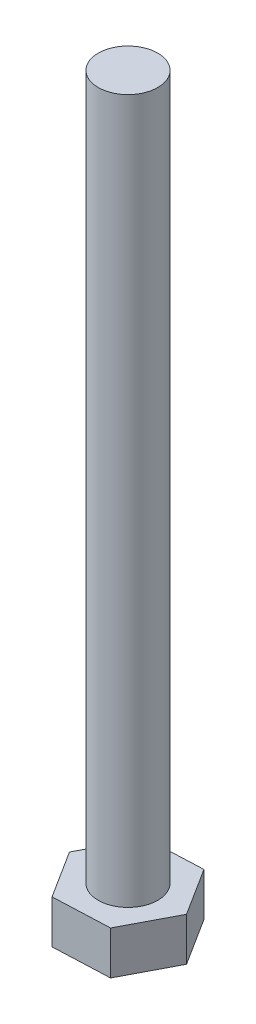
from build123d import *

# Parameters (mm, degrees)
BOSS_EXTRUDE1_DEPTH = 8
SKETCH3_R           = 5.5
BOSS_EXTRUDE2_DEPTH = 130


with BuildPart() as part:
    # Sketch2 → Boss-Extrude1 (new body)
    with BuildSketch(Plane(origin=(0, 0, 0), x_dir=(1, 0, 0), z_dir=(0, 1, 0))):
        Polygon((-5.563002292, 8.777984136), (-10.383458402, -0.428709238), (-4.82045611, -9.206693374), (5.563002292, -8.777984136), (10.383458402, 0.428709238), (4.82045611, 9.206693374), align=None)
    extrude(amount=BOSS_EXTRUDE1_DEPTH)

    # Sketch3 → Boss-Extrude2 (add)
    with BuildSketch(Plane(origin=(0, 8, 0), x_dir=(1, 0, 0), z_dir=(0, 1, 0))):
        with Locations(Location((0, 0, 0), (0, 0, 270))):
            Circle(SKETCH3_R)
    extrude(amount=BOSS_EXTRUDE2_DEPTH)


solid = part.part
